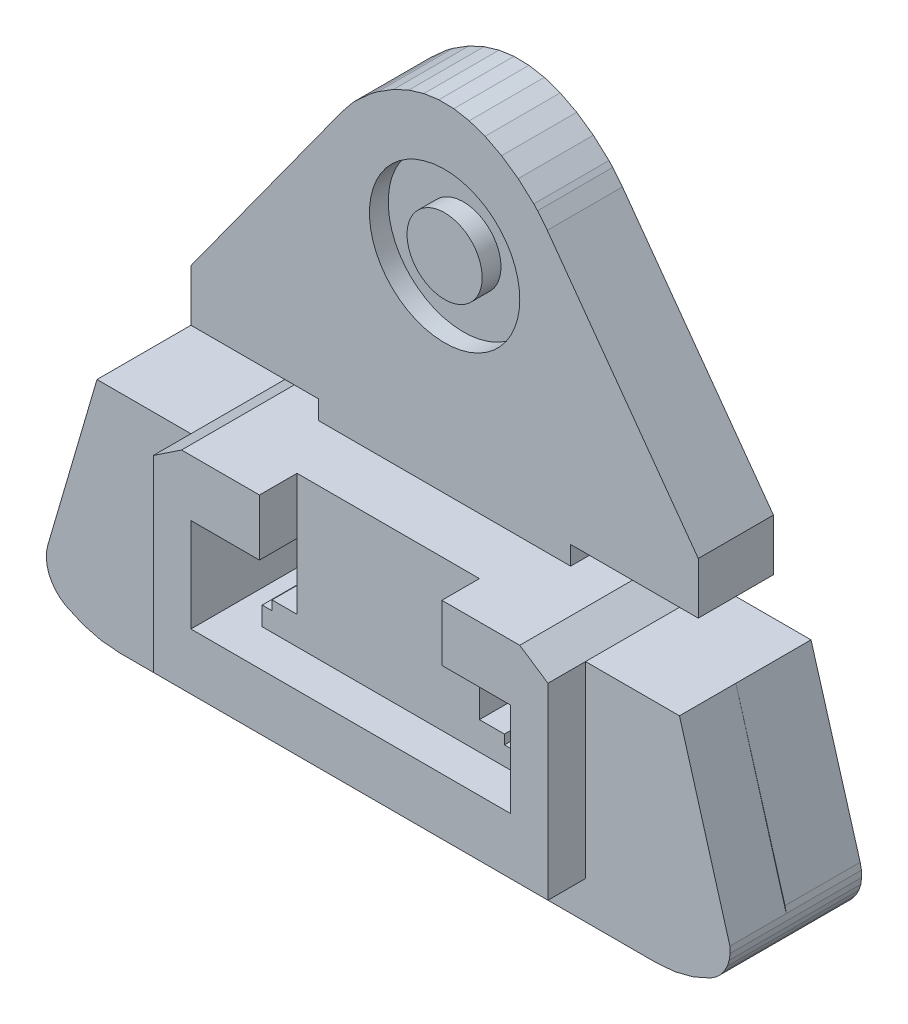
from build123d import *

# Parameters (mm, degrees)
BOSS_EXTRUDE1_DEPTH = 4
SKETCH4_R           = 4
SKETCH4_R_2         = 2
CUT_EXTRUDE1_DEPTH  = 1
BOSS_EXTRUDE2_DEPTH = 3
BOSS_EXTRUDE3_DEPTH = 2
SKETCH9_W           = 10.6
SKETCH9_H           = 4.6
CUT_EXTRUDE2_DEPTH  = 2


with BuildPart() as part:
    # Sketch1 → Boss-Extrude1 (new body)
    with BuildSketch(Plane.XY):
        Polygon((5.464935303, 12.361984253), (13.500030518, 1.254714966), (13.500030518, -1.495285034), (6.708221436, -1.495285034), (6.708221436, -2.495285034), (9.000030518, -2.495285034), (10.500030518, -3.495285034), (15.500030518, -3.495285034), (18.116729736, -12.435714722), (18.183807373, -12.766372681), (18.19442749, -13.103652954), (18.148162842, -13.43788147), (18.046356201, -13.759597778), (17.891937256, -14.059585571), (17.689239502, -14.329391479), (17.444122314, -14.561233521), (17.163482666, -14.74861145), (16.243865967, -15.159500122), (15.268463135, -15.410751343), (14.26473999, -15.495285034), (-14.26473999, -15.495285034), (-15.2684021, -15.410751343), (-16.243865967, -15.159500122), (-17.163482666, -14.74861145), (-17.444122314, -14.561233521), (-17.689239502, -14.329391479), (-17.891937256, -14.059585571), (-18.046356201, -13.759597778), (-18.148162842, -13.43788147), (-18.19442749, -13.103652954), (-18.183807373, -12.766372681), (-18.116729736, -12.435714722), (-15.499969482, -3.495285034), (-10.499969482, -3.495285034), (-8.999969482, -2.495285034), (-6.708221436, -2.495285034), (-6.708221436, -1.495285034), (-13.499969482, -1.495285034), (-13.499969482, 1.254714966), (-5.464935303, 12.361984253), (-4.947479248, 13.004714966), (-4.746734619, 13.221054077), (-3.915679932, 13.971450806), (-3.550689697, 14.243942261), (-2.715545654, 14.767288208), (-1.902435303, 15.142776489), (-1.102752686, 15.383102417), (-0.306915283, 15.495285034), (0.489349365, 15.480758667), (1.307891846, 15.333633423), (2.152435303, 15.041397095), (3.030548096, 14.586288452), (3.915679932, 13.971450806), (4.746795654, 13.221054077), (4.947479248, 13.004714966), align=None)
        Polygon((6.708221436, -10.495285034), (8.500030518, -10.495285034), (8.500030518, -5.495285034), (4.854156494, -5.495285034), (4.854156494, -8.995285034), (6.184661865, -8.995285034), (6.184661865, -9.495285034), (6.708221436, -9.495285034), align=None, mode=Mode.SUBTRACT)
        Polygon((-4.854095459, -5.495285034), (-8.499969482, -5.495285034), (-8.499969482, -10.495285034), (-6.708221436, -10.495285034), (-6.708221436, -9.495285034), (-6.184661865, -9.495285034), (-6.184661865, -8.995285034), (-4.854095459, -8.995285034), align=None, mode=Mode.SUBTRACT)
    extrude(amount=BOSS_EXTRUDE1_DEPTH)

    # Sketch4 → Cut-Extrude1 (cut)
    with BuildSketch(Plane.XY.offset(4)):
        with Locations((0, 8.442743212)):
            Circle(SKETCH4_R)
        with Locations((0, 8.442743212)):
            Circle(SKETCH4_R_2, mode=Mode.SUBTRACT)
    extrude(amount=-CUT_EXTRUDE1_DEPTH, mode=Mode.SUBTRACT)

    # Sketch7 → Boss-Extrude2 (add)
    with BuildSketch(Plane.XY.offset(4)):
        Polygon((-15.499969482, -3.495285034), (-18.116729736, -12.435714722), (-18.150268555, -12.601043701), (-18.183807373, -12.766372681), (-18.189117432, -12.935012817), (-18.19442749, -13.103652954), (-18.171295166, -13.270767212), (-18.148162842, -13.43788147), (-18.046356201, -13.759597778), (-17.891937256, -14.059585571), (-17.689239502, -14.329391479), (-17.444122314, -14.561233521), (-17.163482666, -14.74861145), (-16.243865967, -15.159500122), (-15.2684021, -15.410751343), (-14.26473999, -15.495285034), (14.26473999, -15.495285034), (15.268463135, -15.410751343), (16.243865967, -15.159500122), (17.163482666, -14.74861145), (17.444122314, -14.561233521), (17.689239502, -14.329391479), (17.891937256, -14.059585571), (18.046356201, -13.759597778), (18.148162842, -13.43788147), (18.19442749, -13.103652954), (18.183807373, -12.766372681), (15.500030518, -3.495285034), (10.500030518, -3.495285034), (9.000030518, -2.495285034), (6.708221436, -2.495285034), (-6.708221436, -2.495285034), (-8.999969482, -2.495285034), (-10.499969482, -3.495285034), align=None)
        Polygon((-8.499969482, -5.495285034), (-8.499969482, -10.495285034), (-6.708221436, -10.495285034), (-6.708221436, -9.495285034), (-6.184661865, -9.495285034), (-6.184661865, -8.995285034), (-4.854095459, -8.995285034), (-4.854095459, -5.495285034), align=None, mode=Mode.SUBTRACT)
        Polygon((4.854156494, -5.495285034), (8.500030518, -5.495285034), (8.500030518, -10.495285034), (6.708221436, -10.495285034), (6.708221436, -9.495285034), (6.184661865, -9.495285034), (6.184661865, -8.995285034), (4.854156494, -8.995285034), align=None, mode=Mode.SUBTRACT)
    extrude(amount=BOSS_EXTRUDE2_DEPTH)

    # Sketch8 → Boss-Extrude3 (add)
    with BuildSketch(Plane.XY.offset(7)):
        Polygon((-6.708221436, -2.495285034), (-8.999969482, -2.495285034), (-10.499969482, -3.495285034), (-10.499969482, -13.496460595), (10.500030518, -13.496460595), (10.500030518, -3.495285034), (9.000030518, -2.495285034), (6.708221436, -2.495285034), (4.854156494, -2.495285034), (4.854156494, -5.495285034), (8.500030518, -5.495285034), (8.500030518, -10.495285034), (6.708221436, -10.495285034), (-6.708221436, -10.495285034), (-8.499969482, -10.495285034), (-8.499969482, -5.495285034), (-4.854095459, -5.495285034), (-4.854095459, -2.495285034), align=None)
    extrude(amount=BOSS_EXTRUDE3_DEPTH)

    # Sketch9 → Cut-Extrude2 (cut)
    with BuildSketch(Plane(origin=(0, 0, 0), x_dir=(-1, 0, 0), z_dir=(0, 0, -1))):
        with Locations((0, 6.603957423)):
            Rectangle(SKETCH9_W, SKETCH9_H)
    extrude(amount=-CUT_EXTRUDE2_DEPTH, mode=Mode.SUBTRACT)


solid = part.part
